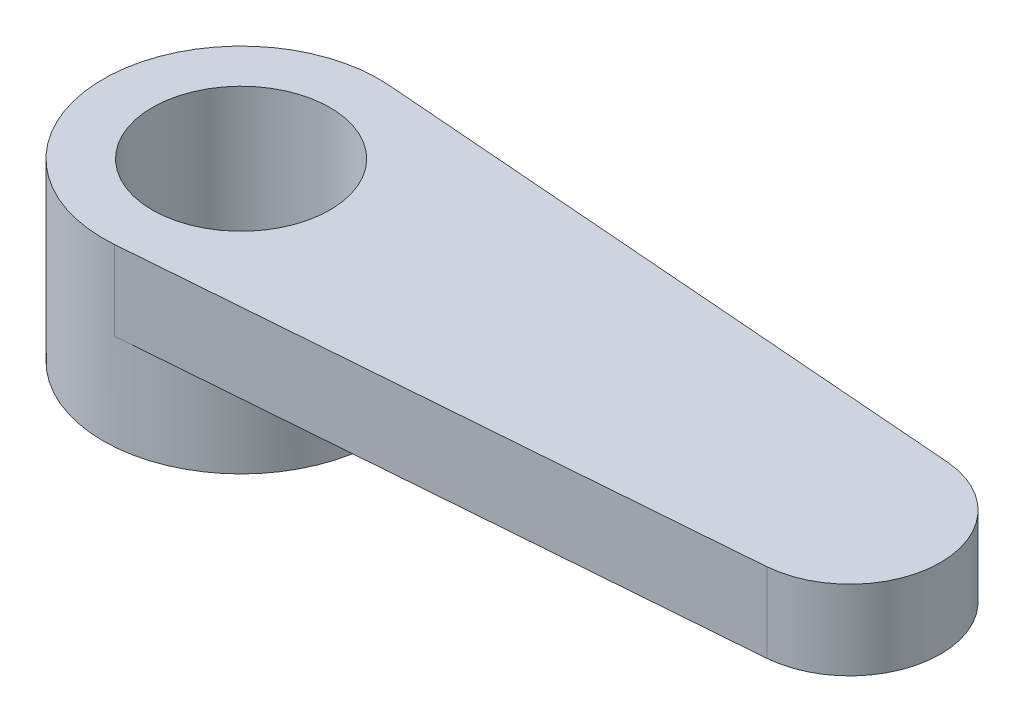
from build123d import *

# Parameters (mm, degrees)
SKETCH1_R           = 3.65
SKETCH1_R_2         = 2.35
BOSS_EXTRUDE1_DEPTH = 4.64
BOSS_EXTRUDE2_START = -2.1
BOSS_EXTRUDE2_DEPTH = 2.1


with BuildPart() as part:
    # Sketch1 → Boss-Extrude1 (new body)
    with BuildSketch(Plane(origin=(0, 0, 0), x_dir=(1, 0, 0), z_dir=(0, 1, 0))):
        with Locations(Location((0, 0, 0), (0, 0, 270))):
            Circle(SKETCH1_R)
        with Locations(Location((0, 0, 0), (0, 0, 270))):
            Circle(SKETCH1_R_2, mode=Mode.SUBTRACT)
    extrude(amount=BOSS_EXTRUDE1_DEPTH)

    # Sketch2 → Boss-Extrude2 (add)
    with BuildSketch(Plane(origin=(0, 4.64, 0), x_dir=(1, 0, 0), z_dir=(0, 1, 0)).offset(BOSS_EXTRUDE2_START)):
        with BuildLine():
            Line((0.283385093, 3.638982397), (16.303738301, 2.391400302))
            ThreePointArc((16.303738301, 2.391400302), (18.500063478, 0), (16.303738301, -2.391400302))
            Line((16.303738301, -2.391400302), (0.283385093, -3.638982397))
            ThreePointArc((0.283385093, -3.638982397), (3.65, 0), (0.283385093, 3.638982397))
        make_face()
    extrude(amount=BOSS_EXTRUDE2_DEPTH)


solid = part.part
